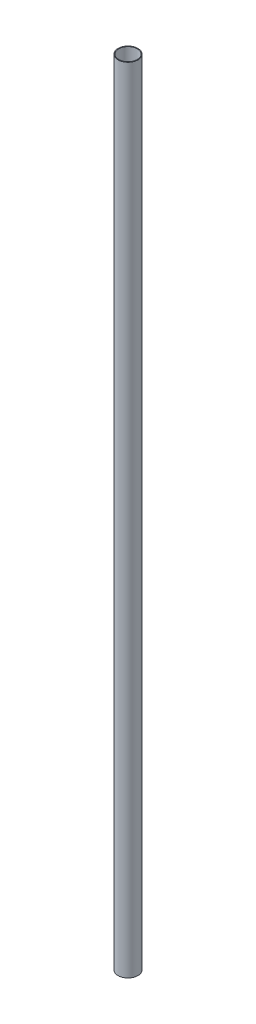
from build123d import *

# Parameters (mm, degrees)
SKETCH1_R           = 3.5
SKETCH1_R_2         = 3.25
BOSS_EXTRUDE1_DEPTH = 278


with BuildPart() as part:
    # Sketch1 → Boss-Extrude1 (new body)
    with BuildSketch(Plane(origin=(0, 0, 0), x_dir=(1, 0, 0), z_dir=(0, 1, 0))):
        with Locations(Location((0, 0, 0), (0, 0, 270))):
            Circle(SKETCH1_R)
        with Locations(Location((0, 0, 0), (0, 0, 270))):
            Circle(SKETCH1_R_2, mode=Mode.SUBTRACT)
    extrude(amount=BOSS_EXTRUDE1_DEPTH)


solid = part.part
